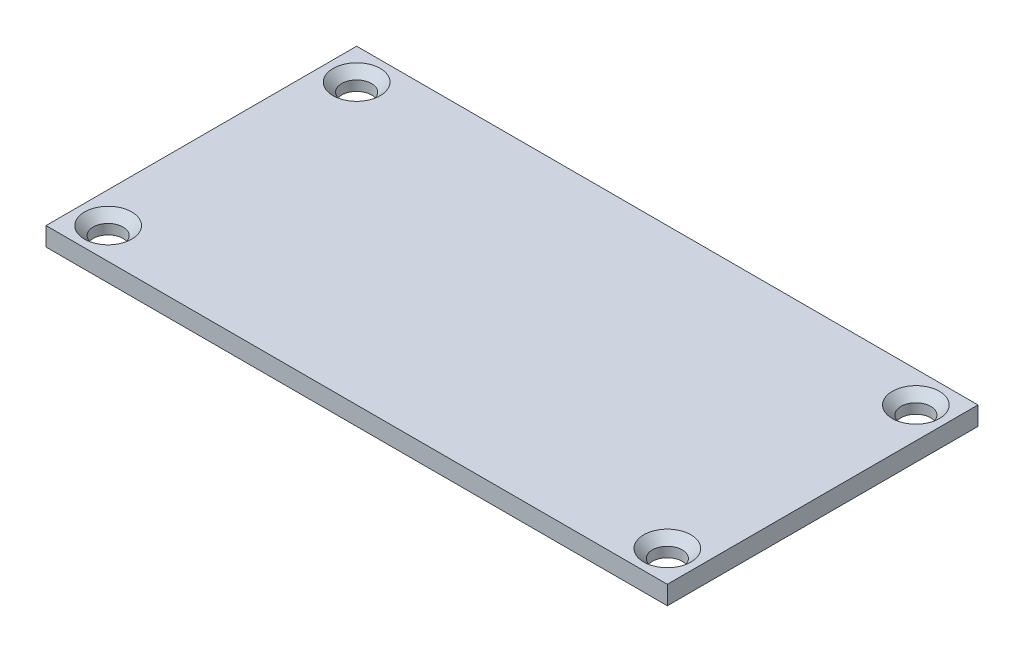
from build123d import *

# Parameters (mm, degrees)
SKETCH_1_W                  = 50
SKETCH_1_H                  = 25
EXTRUDE_1_DEPTH             = 1.5
PATTERN_LINEAR_1_COUNT      = 2
PATTERN_LINEAR_1_PITCH      = 45
PATTERN_LINEAR_1_COUNT_DIR2 = 2
PATTERN_LINEAR_1_PITCH_DIR2 = 20


with BuildPart() as part:
    # 草图1 → 凸台-拉伸1 (new body)
    with BuildSketch(Plane(origin=(0, 0, 0), x_dir=(1, 0, 0), z_dir=(0, 1, 0))):
        with Locations((25, 12.5)):
            Rectangle(SKETCH_1_W, SKETCH_1_H)
    extrude(amount=EXTRUDE_1_DEPTH)

    # 草图3 → M2 平头机械螺钉的锥形沉头孔1 (revolve, cut)
    with BuildSketch(Plane(origin=(2.5, 1.5, -22.5), x_dir=(0, 0, 1), z_dir=(1, 0, 0))):
        Polygon((0, 0), (0, 8.721032743), (1.2, 8), (1.2, 0.7), (1.9, 0), align=None)
    hole_wizard_m2_1 = revolve(axis=Axis((2.5, 7.85, -22.5), (0, -1, 0)), mode=Mode.SUBTRACT)

    # 阵列(线性)1: Hole Wizard M2 _1 2 × 2
    with Locations(*[(i * PATTERN_LINEAR_1_PITCH, 0, j * PATTERN_LINEAR_1_PITCH_DIR2) for i in range(PATTERN_LINEAR_1_COUNT) for j in range(PATTERN_LINEAR_1_COUNT_DIR2) if (i, j) != (0, 0)]):
        add(hole_wizard_m2_1, mode=Mode.SUBTRACT)


solid = part.part
